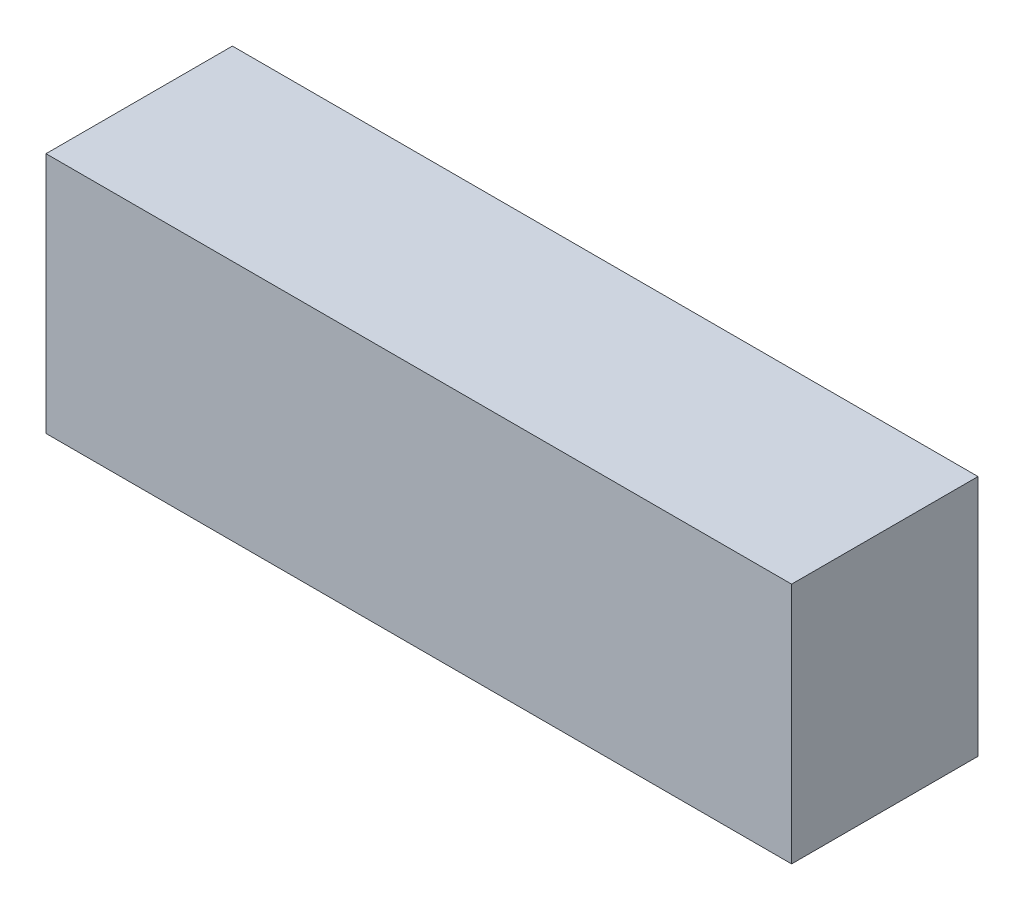
from build123d import *

# Parameters (mm, degrees)
SKETCH1_W           = 40
SKETCH1_H           = 13
BOSS_EXTRUDE1_DEPTH = 10


with BuildPart() as part:
    # Sketch1 → Boss-Extrude1 (new body)
    with BuildSketch(Plane.XY):
        with Locations((20, 6.5)):
            Rectangle(SKETCH1_W, SKETCH1_H)
    extrude(amount=-BOSS_EXTRUDE1_DEPTH)


solid = part.part
